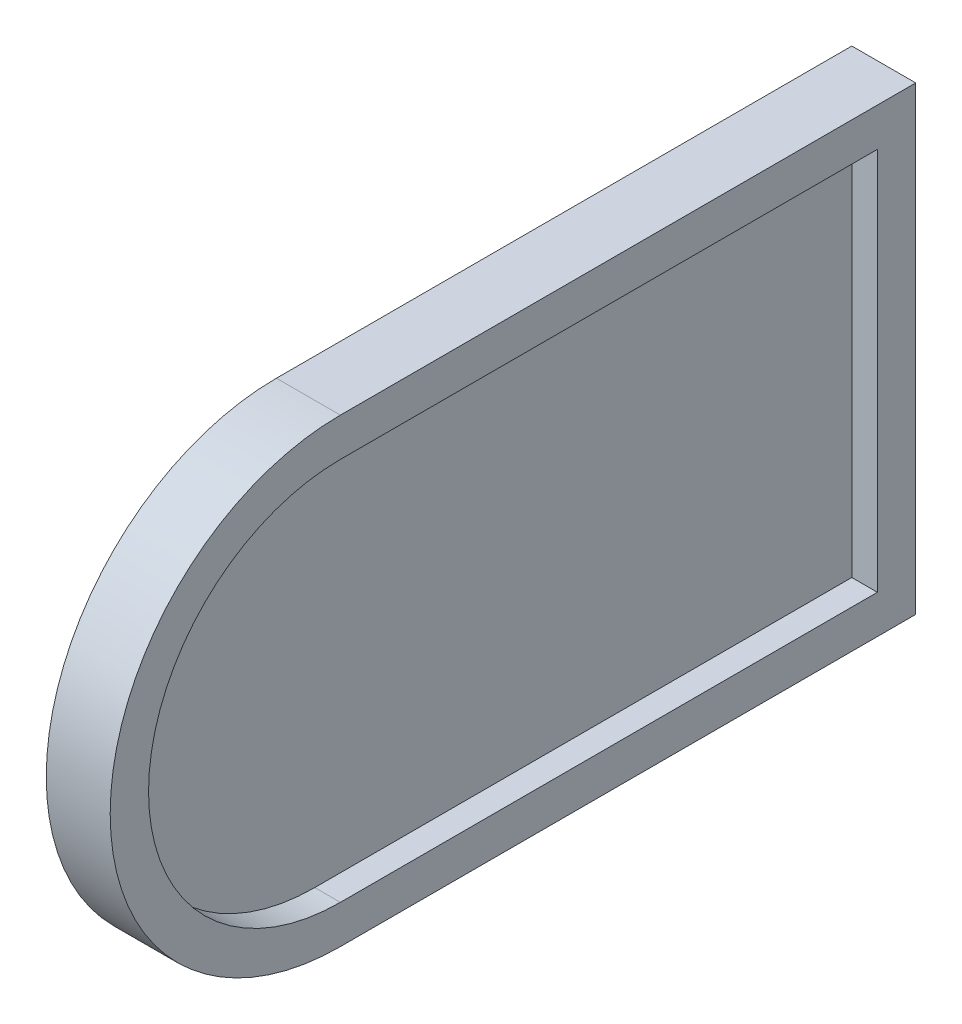
from build123d import *

# Parameters (mm, degrees)
BOSS_EXTRUDE1_DEPTH = 5
SHELL1_T            = -3


with BuildPart() as part:
    # Sketch1 → Boss-Extrude1 (new body)
    with BuildSketch(Plane(origin=(0, 0, 0), x_dir=(0, 0, -1), z_dir=(1, 0, 0))):
        with BuildLine():
            Line((0, 18), (45, 18))
            Line((45, 18), (45, -18))
            Line((45, -18), (0, -18))
            ThreePointArc((0, -18), (-18, 0), (0, 18))
        make_face()
    extrude(amount=BOSS_EXTRUDE1_DEPTH)

    # Shell1
    shell1_openings = [part.faces().sort_by_distance(p)[0] for p in [
        (5, 0, -15.294949805),
    ]]
    offset(amount=SHELL1_T, openings=shell1_openings, kind=Kind.INTERSECTION)


solid = part.part
